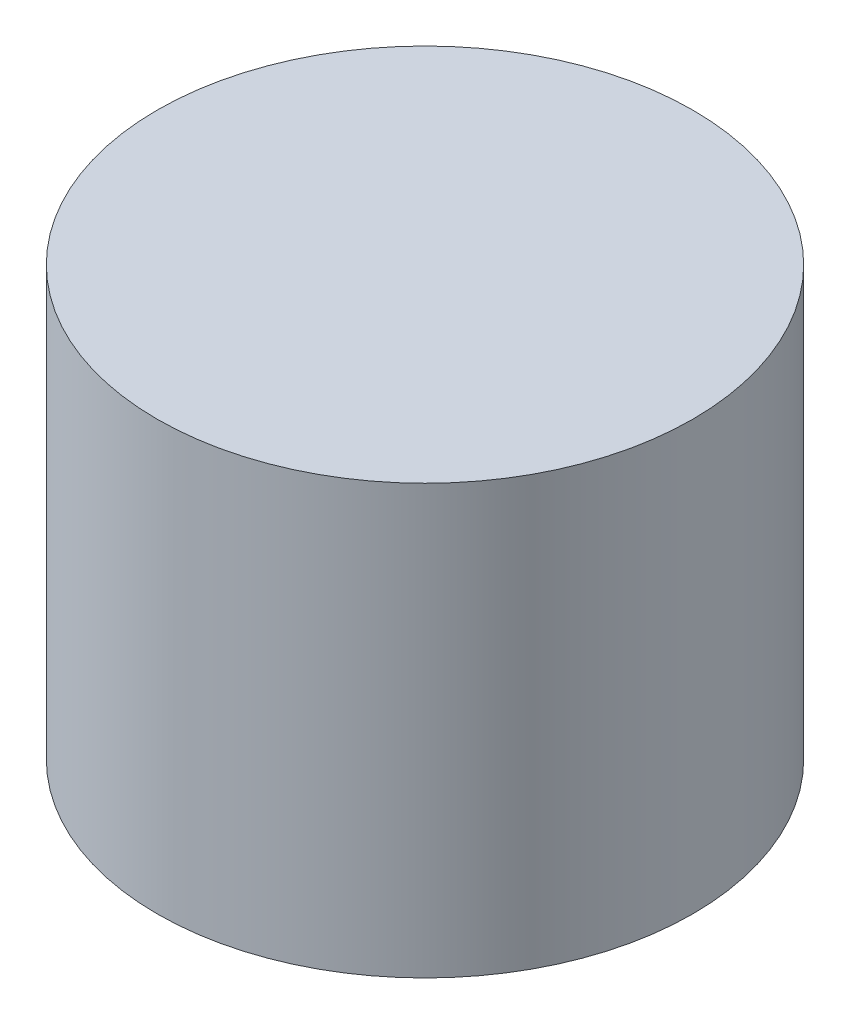
from build123d import *

# Parameters (mm, degrees)
SKETCH1_R           = 6.25
BOSS_EXTRUDE1_DEPTH = 10


with BuildPart() as part:
    # Sketch1 → Boss-Extrude1 (new body)
    with BuildSketch(Plane(origin=(0, 0, 0), x_dir=(1, 0, 0), z_dir=(0, 1, 0))):
        with Locations(Location((0, 0, 0), (0, 0, 270))):
            Circle(SKETCH1_R)
    extrude(amount=BOSS_EXTRUDE1_DEPTH)


solid = part.part
